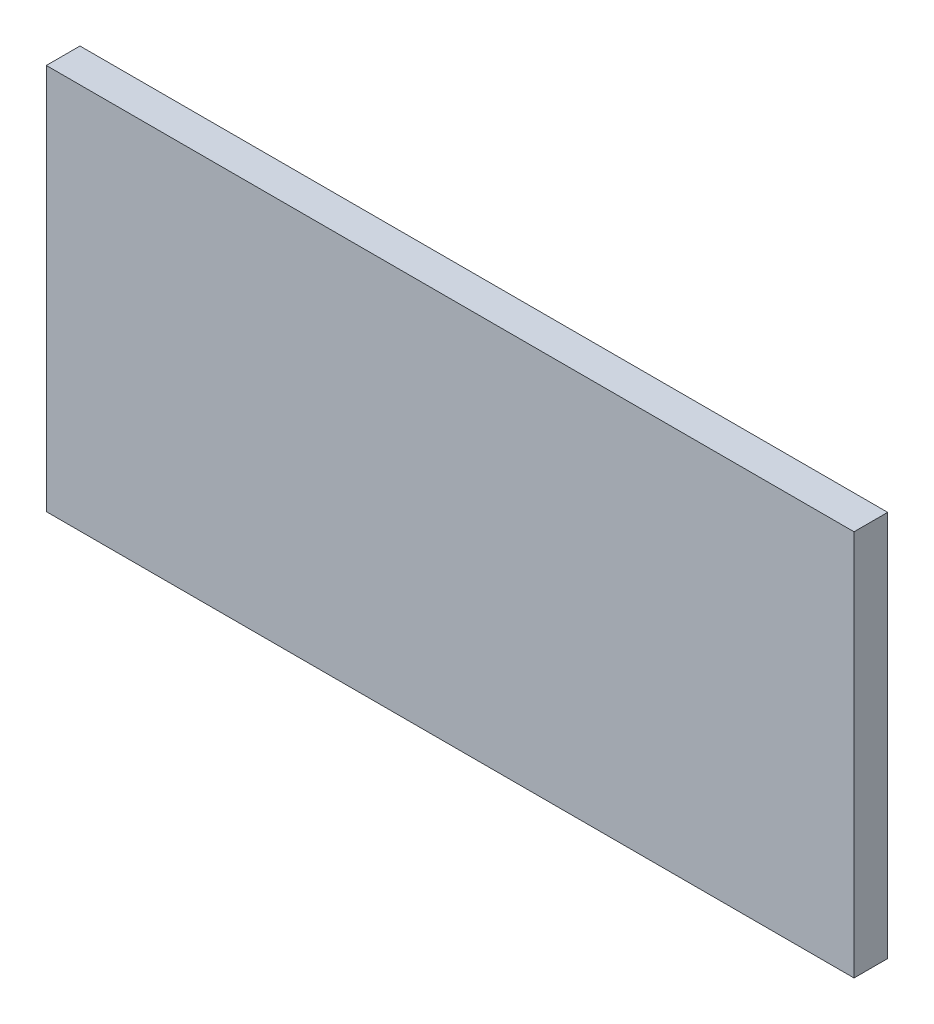
from build123d import *

# Parameters (mm, degrees)
CROQUIS1_W              = 240
CROQUIS1_H              = 114.83
SALIENTE_EXTRUIR1_DEPTH = 10


with BuildPart() as part:
    # Croquis1 → Saliente-Extruir1 (new body)
    with BuildSketch(Plane.XY):
        with Locations((120, 57.415)):
            Rectangle(CROQUIS1_W, CROQUIS1_H)
    extrude(amount=SALIENTE_EXTRUIR1_DEPTH)


solid = part.part
